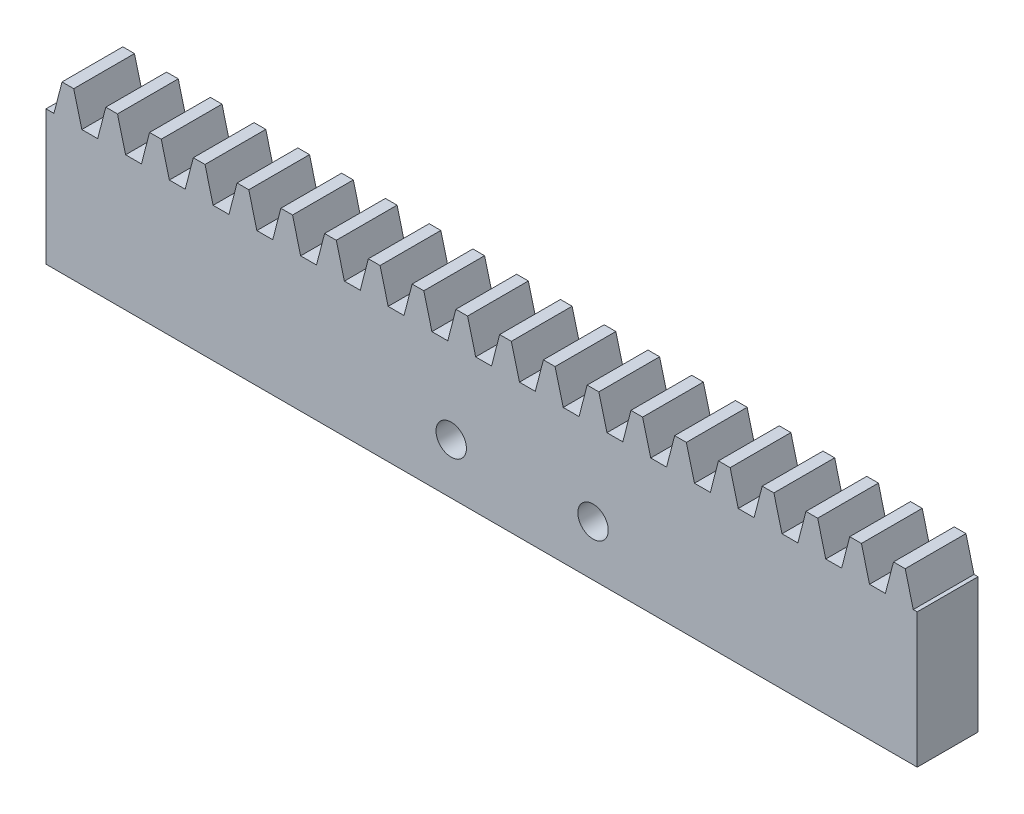
from build123d import *

# Parameters (mm, degrees)
BLANKSKE_W              = 86
BLANKSKE_H              = 16.375
BLANK_DEPTH             = 6
TOOTHCUTSIM_DEPTH       = 88.750445156
TEETHCUTS_COUNT         = 21
TEETHCUTS_PITCH         = 4.319689894
ESQUISSE1_R             = 1.5
ENL_V_MAT_EXTRU_1_DEPTH = 88.750445156


with BuildPart() as part:
    # BlankSke → Blank (new body)
    with BuildSketch(Plane.XY):
        with Locations((43, 8.1875)):
            Rectangle(BLANKSKE_W, BLANKSKE_H)
    extrude(amount=-BLANK_DEPTH)

    # TooCutSkeSim → ToothCutSim (cut, through all)
    with BuildSketch(Plane.XY):
        Polygon((0.7824235, 13.28125), (-0.7824235, 13.28125), (-1.589090539, 16.4004), (1.589090539, 16.4004), align=None)
    toothcutsim = extrude(amount=-TOOTHCUTSIM_DEPTH, mode=Mode.SUBTRACT)

    # TeethCuts: ToothCutSim ×21
    with Locations(*[(i * TEETHCUTS_PITCH, 0, 0) for i in range(1, TEETHCUTS_COUNT)]):
        add(toothcutsim, mode=Mode.SUBTRACT)

    # Esquisse1 → Enlèv. mat.-Extru.1 (cut, through all)
    with BuildSketch(Plane.XY):
        with Locations((40, 5)):
            Circle(ESQUISSE1_R)
        with Locations((54, 5)):
            Circle(ESQUISSE1_R)
    extrude(amount=-ENL_V_MAT_EXTRU_1_DEPTH, mode=Mode.SUBTRACT)


solid = part.part
